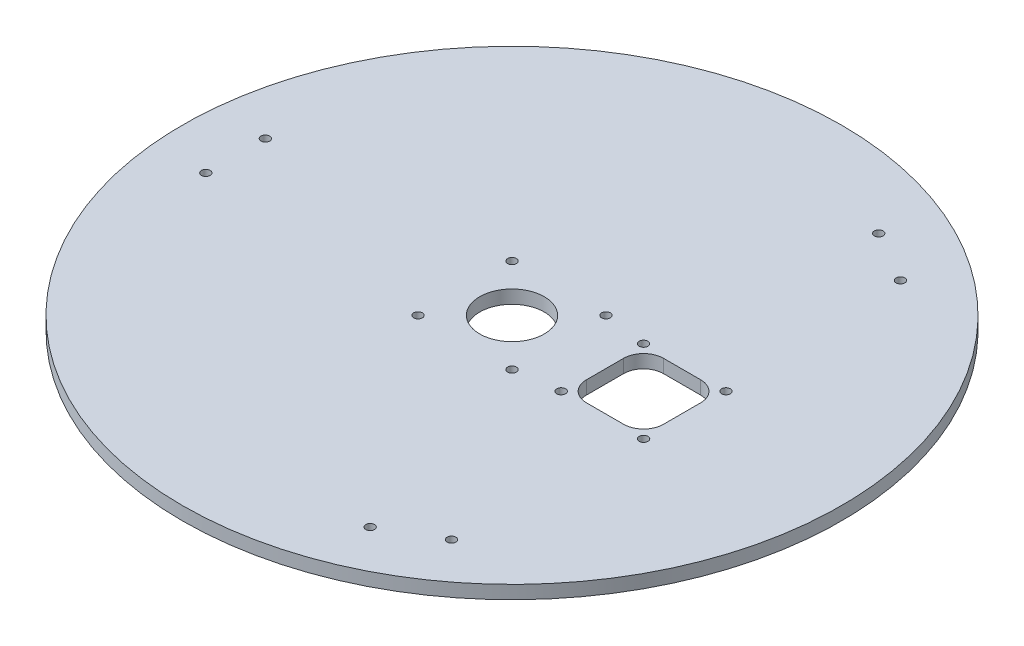
from build123d import *

# Parameters (mm, degrees)
LASER_HOLES_R       = 124
LASER_HOLES_R_2     = 1.65
LASER_HOLES_R_3     = 12.15
BOSS_EXTRUDE4_DEPTH = 5


with BuildPart() as part:
    # Laser holes → Boss-Extrude4 (new body)
    with BuildSketch(Plane(origin=(0, 0, 0), x_dir=(1, 0, 0), z_dir=(0, 1, 0))):
        with Locations(Location((-49.5, 0, 0), (0, 0, 270))):
            Circle(LASER_HOLES_R)
        with Locations(Location((15.5, 15.5, 0), (0, 0, 270))):
            Circle(LASER_HOLES_R_2, mode=Mode.SUBTRACT)
        with Locations(Location((-15.5, 15.5, 0), (0, 0, 90))):
            Circle(LASER_HOLES_R_2, mode=Mode.SUBTRACT)
        with Locations(Location((-15.5, -15.5, 0), (0, 0, 270))):
            Circle(LASER_HOLES_R_2, mode=Mode.SUBTRACT)
        with Locations(Location((15.5, -15.5, 0), (0, 0, 90))):
            Circle(LASER_HOLES_R_2, mode=Mode.SUBTRACT)
        with Locations(Location((-31.82233047, 17.67766953, 0), (0, 0, 270))):
            Circle(LASER_HOLES_R_2, mode=Mode.SUBTRACT)
        with Locations(Location((-67.17766953, 17.67766953, 0), (0, 0, 270))):
            Circle(LASER_HOLES_R_2, mode=Mode.SUBTRACT)
        with Locations(Location((-67.17766953, -17.67766953, 0), (0, 0, 270))):
            Circle(LASER_HOLES_R_2, mode=Mode.SUBTRACT)
        with Locations(Location((-31.82233047, -17.67766953, 0), (0, 0, 270))):
            Circle(LASER_HOLES_R_2, mode=Mode.SUBTRACT)
        with Locations(Location((-49.5, 0, 0), (0, 0, 270))):
            Circle(LASER_HOLES_R_3, mode=Mode.SUBTRACT)
        with Locations(Location((-153.5, 11.2, 0), (0, 0, 270))):
            Circle(LASER_HOLES_R_2, mode=Mode.SUBTRACT)
        with Locations(Location((-153.5, -11.2, 0), (0, 0, 90))):
            Circle(LASER_HOLES_R_2, mode=Mode.SUBTRACT)
        with Locations(Location((-7.199484522, 95.666641994, 0), (0, 0, 90))):
            Circle(LASER_HOLES_R_2, mode=Mode.SUBTRACT)
        with Locations(Location((12.199484522, 84.466641994, 0), (0, 0, 270))):
            Circle(LASER_HOLES_R_2, mode=Mode.SUBTRACT)
        with Locations(Location((12.199484522, -84.466641994, 0), (0, 0, 90))):
            Circle(LASER_HOLES_R_2, mode=Mode.SUBTRACT)
        with Locations(Location((-7.199484522, -95.666641994, 0), (0, 0, 270))):
            Circle(LASER_HOLES_R_2, mode=Mode.SUBTRACT)
        with BuildLine():
            Line((14.5, -7), (14.5, 7))
            ThreePointArc((14.5, 7), (12.303300859, 12.303300859), (7, 14.5))
            Line((7, 14.5), (-7, 14.5))
            ThreePointArc((-7, 14.5), (-12.303300859, 12.303300859), (-14.5, 7))
            Line((-14.5, 7), (-14.5, -7))
            ThreePointArc((-14.5, -7), (-12.303300859, -12.303300859), (-7, -14.5))
            Line((-7, -14.5), (7, -14.5))
            ThreePointArc((7, -14.5), (12.303300859, -12.303300859), (14.5, -7))
        make_face(mode=Mode.SUBTRACT)
    extrude(amount=BOSS_EXTRUDE4_DEPTH)


solid = part.part
